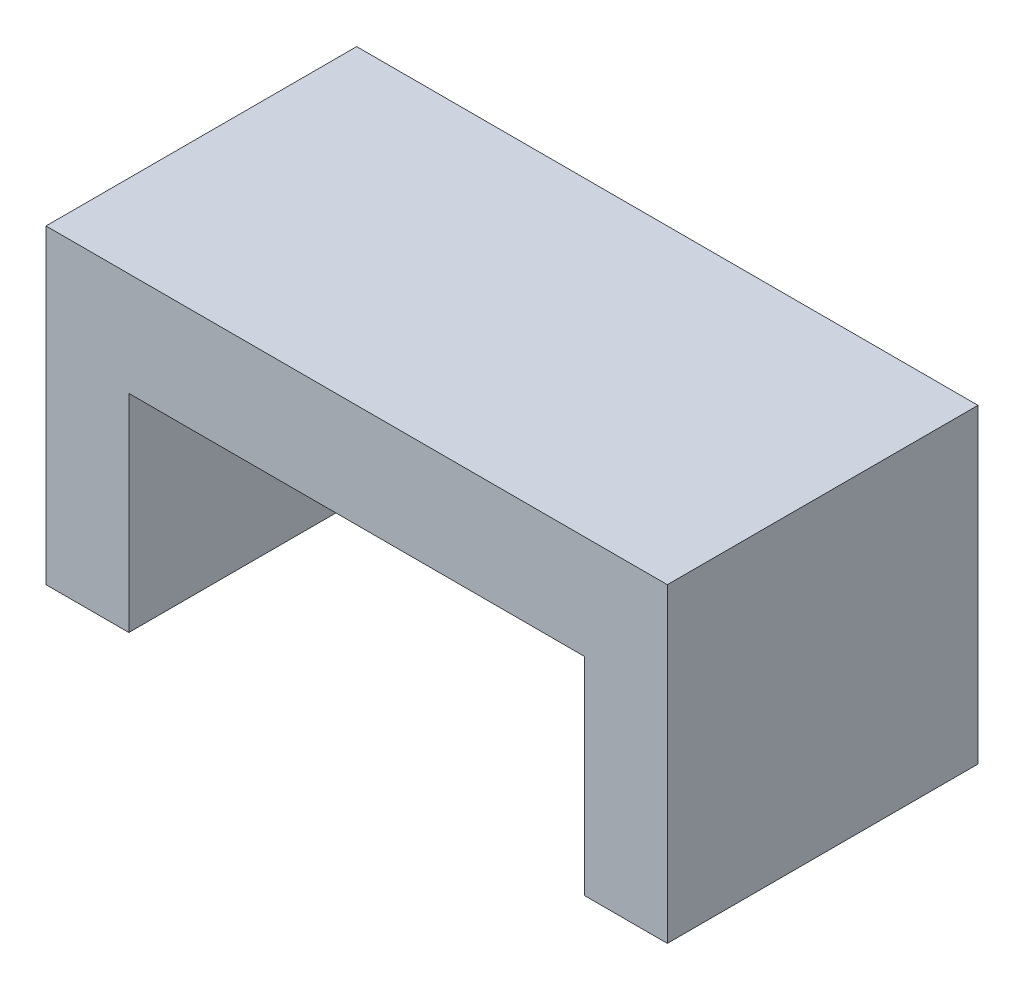
from build123d import *

# Parameters (mm, degrees)
SKETCH2_W                = 4
SKETCH2_H                = 15
BOSS_EXTRUDE1_DEPTH      = 10
BOSS_EXTRUDE1_2_DEPTH    = 10
BOSS_EXTRUDE2_DEPTH      = 7.5
BOSS_EXTRUDE2_DEPTH_BACK = 7.5
SKETCH3_W                = 30
SKETCH3_H                = 5


with BuildPart() as part:
    # Sketch2 → Boss-Extrude1 (new body)
    with BuildSketch(Plane(origin=(0, 0, 0), x_dir=(1, 0, 0), z_dir=(0, 1, 0))):
        with Locations((-13, 0)):
            Rectangle(SKETCH2_W, SKETCH2_H)
    extrude(amount=-BOSS_EXTRUDE1_DEPTH)



with BuildPart() as body_2:
    # Sketch2 → Boss-Extrude1 2 (new body)
    with BuildSketch(Plane(origin=(0, 0, 0), x_dir=(1, 0, 0), z_dir=(0, 1, 0))):
        with Locations((13, 0)):
            Rectangle(SKETCH2_W, SKETCH2_H)
    extrude(amount=-BOSS_EXTRUDE1_2_DEPTH)


with BuildPart() as part_1:
    add(part.part)

    add(body_2.part)  # Boss-Extrude2 merges body 2
    # Sketch3 → Boss-Extrude2 (add, two sides: drawn at the far end of the back side and taken through both)
    with BuildSketch(Plane.XY.offset(-BOSS_EXTRUDE2_DEPTH_BACK)):
        with Locations((0, 2.5)):
            Rectangle(SKETCH3_W, SKETCH3_H)
    extrude(amount=BOSS_EXTRUDE2_DEPTH + BOSS_EXTRUDE2_DEPTH_BACK)


solid = part_1.part
